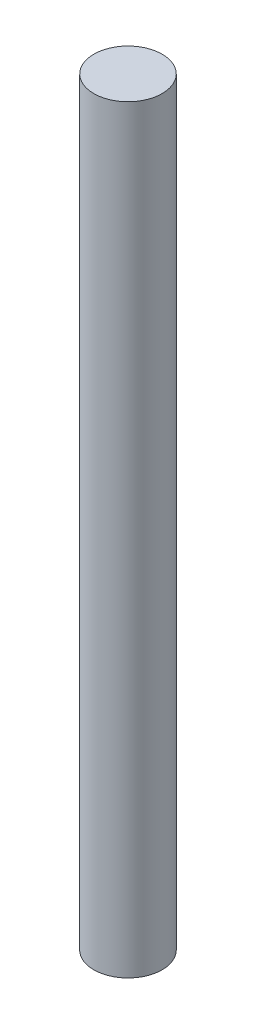
from build123d import *

# Parameters (mm, degrees)
SKETCH2_R = 6.75


with BuildPart() as part:
    # Sweep1: sweep along a path in Sketch1
    with BuildLine(Plane.XY) as sweep1_path:
        Line((0, 0), (0, 150))
    # Sketch2 → Sweep1 (sweep)
    with BuildSketch(Plane(origin=(0, 0, 0), x_dir=(1, 0, 0), z_dir=(0, 1, 0))):
        Circle(SKETCH2_R)
    sweep(path=sweep1_path.line)


solid = part.part
